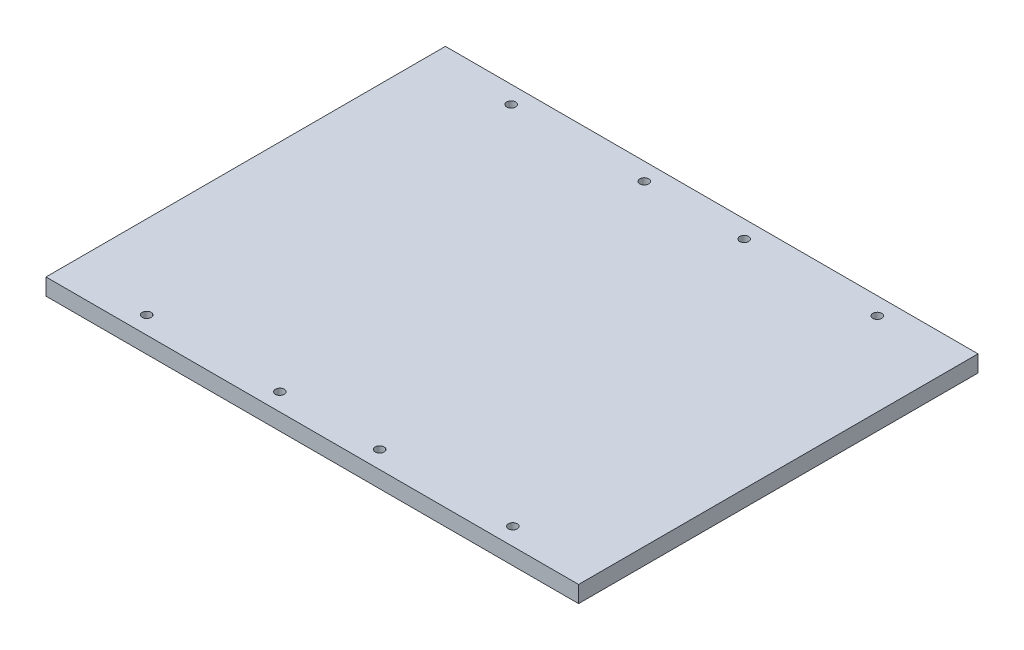
from build123d import *

# Parameters (mm, degrees)
SKETCH1_W           = 203.2
SKETCH1_H           = 152.4
SKETCH1_R           = 1.7
BOSS_EXTRUDE1_DEPTH = 6.35


with BuildPart() as part:
    # Sketch1 → Boss-Extrude1 (new body)
    with BuildSketch(Plane(origin=(0, 0, 0), x_dir=(1, 0, 0), z_dir=(0, 1, 0))):
        Rectangle(SKETCH1_W, SKETCH1_H)
        with Locations(Location((-69.85, 69.5325, 0), (0, 0, 270))):
            Circle(SKETCH1_R, mode=Mode.SUBTRACT)
        with Locations(Location((-19.05, 69.5325, 0), (0, 0, 270))):
            Circle(SKETCH1_R, mode=Mode.SUBTRACT)
        with Locations(Location((19.05, 69.5325, 0), (0, 0, 270))):
            Circle(SKETCH1_R, mode=Mode.SUBTRACT)
        with Locations(Location((69.85, 69.5325, 0), (0, 0, 270))):
            Circle(SKETCH1_R, mode=Mode.SUBTRACT)
        with Locations(Location((-69.85, -69.5325, 0), (0, 0, 90))):
            Circle(SKETCH1_R, mode=Mode.SUBTRACT)
        with Locations(Location((69.85, -69.5325, 0), (0, 0, 90))):
            Circle(SKETCH1_R, mode=Mode.SUBTRACT)
        with Locations(Location((19.05, -69.5325, 0), (0, 0, 90))):
            Circle(SKETCH1_R, mode=Mode.SUBTRACT)
        with Locations(Location((-19.05, -69.5325, 0), (0, 0, 90))):
            Circle(SKETCH1_R, mode=Mode.SUBTRACT)
    extrude(amount=BOSS_EXTRUDE1_DEPTH)


solid = part.part
